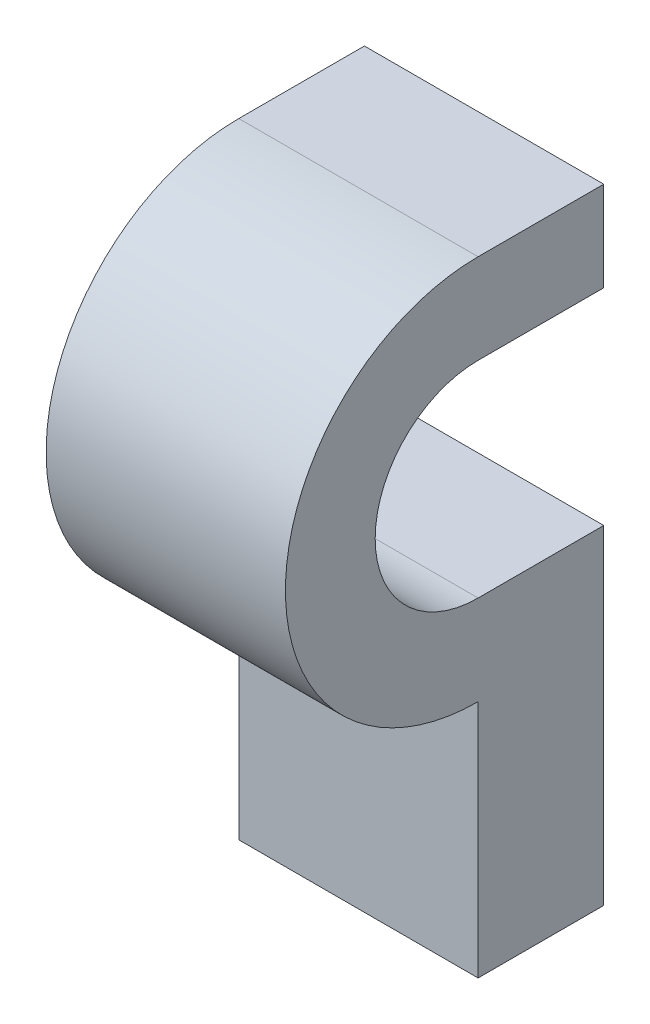
from build123d import *

# Parameters (mm, degrees)
BOSS_EXTRUDE1_DEPTH              = 8
CLAMPMOUNTHOLESKETCH2_R          = 2
CLAMPMOUNTHOLECUT_EXTRUDE1_DEPTH = 4.1


with BuildPart() as part:
    # Sketch1 → Boss-Extrude1 (new body)
    with BuildSketch(Plane(origin=(0, 0, 0), x_dir=(0, 0, -1), z_dir=(1, 0, 0))):
        with BuildLine():
            Line((0, 1.381049961), (0, -9.618950039))
            Line((0, -9.618950039), (-4.2, -9.618950039))
            Line((-4.2, -9.618950039), (-4.2, -1.618950039))
            ThreePointArc((-4.2, -1.618950039), (-10.64, 4.821049961), (-4.2, 11.261049961))
            Line((-4.2, 11.261049961), (0, 11.261049961))
            Line((0, 11.261049961), (0, 8.261049961))
            Line((0, 8.261049961), (-4.2, 8.261049961))
            ThreePointArc((-4.2, 8.261049961), (-7.64, 4.821049961), (-4.2, 1.381049961))
            Line((-4.2, 1.381049961), (0, 1.381049961))
        make_face()
    extrude(amount=BOSS_EXTRUDE1_DEPTH)

    # ClampMountHoleSketch2 → ClampMountHoleCut-Extrude1 (cut)
    with BuildSketch(Plane(origin=(0, 0, 0), x_dir=(-1, 0, 0), z_dir=(0, 0, -1))):
        with Locations(Location((-4, -5.618950039, 0), (0, 0, 90))):
            Circle(CLAMPMOUNTHOLESKETCH2_R)
    extrude(amount=-CLAMPMOUNTHOLECUT_EXTRUDE1_DEPTH, mode=Mode.SUBTRACT)


solid = part.part
